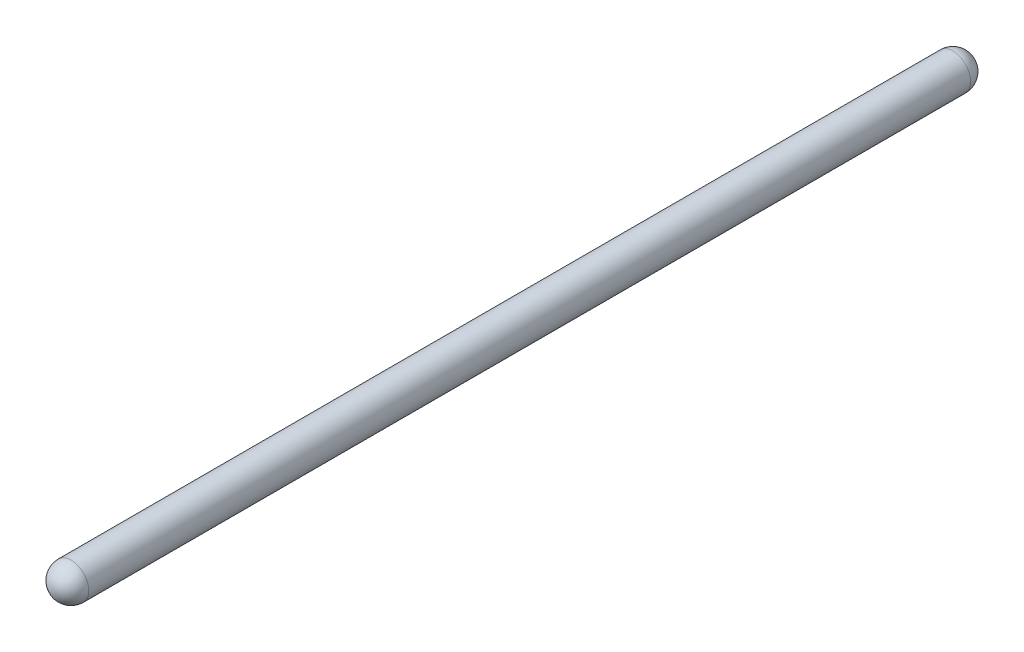
from build123d import *

# Parameters (mm, degrees)
SKETCH_1_R      = 6
EXTRUDE_1_DEPTH = 310
FILLET_3_R      = 6
FILLET_4_R      = 6


with BuildPart() as part:
    # Эскиз1 → Бобышка-Вытянуть1 (new body)
    with BuildSketch(Plane.XY):
        Circle(SKETCH_1_R)
    extrude(amount=EXTRUDE_1_DEPTH)

    # Скругление3
    fillet_3_edges = [part.edges().sort_by_distance(p)[0] for p in [
        (-6, 0, 310),
    ]]
    fillet(fillet_3_edges, radius=FILLET_3_R)

    # Скругление4
    fillet_4_edges = [part.edges().sort_by_distance(p)[0] for p in [
        (-6, 0, 0),
    ]]
    fillet(fillet_4_edges, radius=FILLET_4_R)


solid = part.part
